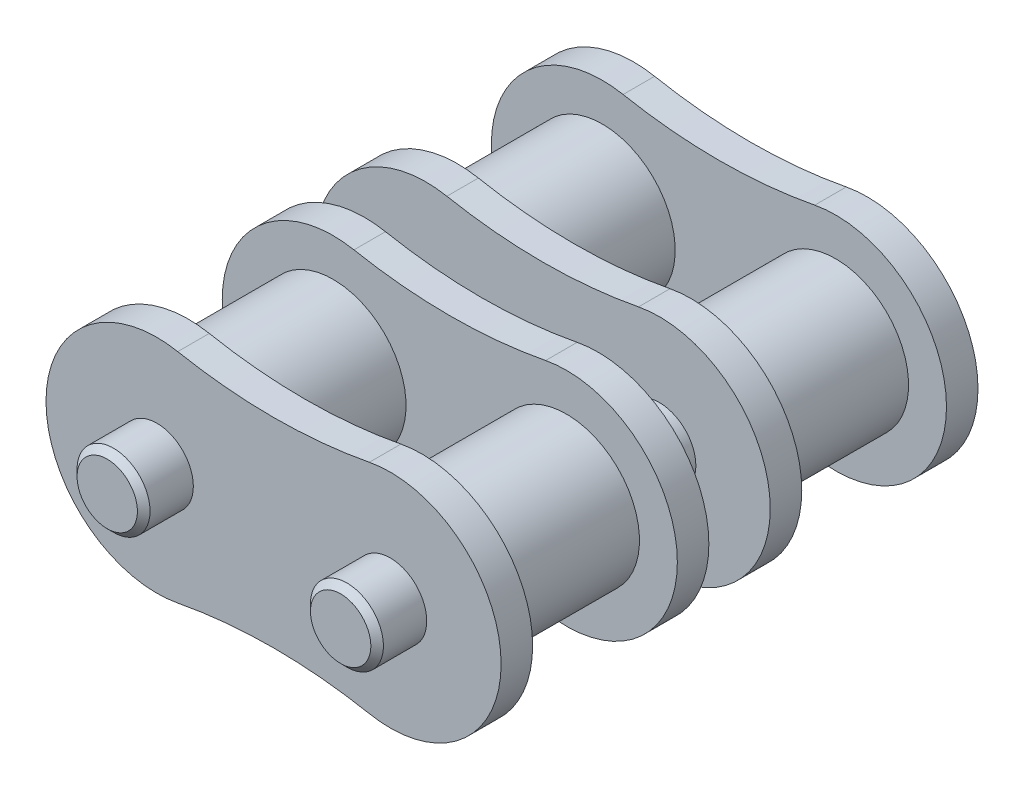
from build123d import *

# Parameters (mm, degrees)
SKETCH_2_R             = 7.94
EXTRUDE_1_DEPTH        = 7.875
EXTRUDE_1_2_DEPTH      = 7.875
EXTRUDE_2_DEPTH        = 3.43
PATTERN_LINEAR_1_COUNT = 2
PATTERN_LINEAR_1_PITCH = 29.29
EXTRUDE_3_DEPTH        = 45.995
EXTRUDE_3_DEPTH_BACK   = 16.705
SKETCH_4_R             = 3.97
CHAMFER_1_SIZE         = 0.686


with BuildPart() as part:
    # 草图2 → 拉伸1 (new, symmetric)
    with BuildSketch(Plane.XY):
        with Locations((12.7, 0)):
            Circle(SKETCH_2_R)
    extrude(amount=EXTRUDE_1_DEPTH, both=True)



with BuildPart() as body_2:
    # 草图2 → Extrude 1 2 (new, symmetric)
    with BuildSketch(Plane.XY):
        with Locations((-12.7, 0)):
            Circle(SKETCH_2_R)
    extrude(amount=EXTRUDE_1_2_DEPTH, both=True)


with BuildPart() as part_1:
    add(part.part)

    add(body_2.part)  # 拉伸2 merges body 2
    # 草图3 → 拉伸2 (add)
    with BuildSketch(Plane.XY.offset(7.875)):
        with BuildLine():
            ThreePointArc((-10.428153415, 11.849174574), (-24.765, 0), (-10.428153415, -11.849174574))
            ThreePointArc((-10.428153415, -11.849174574), (0, -10.8585), (10.428153415, -11.849174574))
            ThreePointArc((10.428153415, -11.849174574), (24.765, 0), (10.428153415, 11.849174574))
            ThreePointArc((10.428153415, 11.849174574), (0, 10.8585), (-10.428153415, 11.849174574))
        make_face()
    extrude_2 = extrude(amount=EXTRUDE_2_DEPTH)

    # 镜向1: 拉伸2 across plane
    add(extrude_2.mirror(Plane.XY))


with BuildPart() as pattern_linear_1_1:
    # 阵列(线性)1: pattern copy
    add(part_1.part.moved(Location(Vector(0, 0, 1) * (1 * PATTERN_LINEAR_1_PITCH))))


with BuildPart() as part_2:
    add(part_1.part)

    add(pattern_linear_1_1.part)  # 拉伸3 merges 阵列(线性)1_1
    # 草图4 → 拉伸3 (add, two sides: drawn at the far end of the back side and taken through both)
    with BuildSketch(Plane.XY.offset(-EXTRUDE_3_DEPTH_BACK)):
        with Locations(Location((12.7, 0, 0), (0, 0, 180))):
            Circle(SKETCH_4_R)
        with Locations(Location((-12.7, 0, 0), (0, 0, 180))):
            Circle(SKETCH_4_R)
    extrude(amount=EXTRUDE_3_DEPTH + EXTRUDE_3_DEPTH_BACK)

    # 倒角1
    chamfer_1_edges = [part_2.edges().sort_by_distance(p)[0] for p in [
        (16.67, 0, -16.705),
        (16.67, 0, 45.995),
        (-8.73, 0, -16.705),
        (-8.73, 0, 45.995),
    ]]
    chamfer(chamfer_1_edges, length=CHAMFER_1_SIZE)


solid = part_2.part
